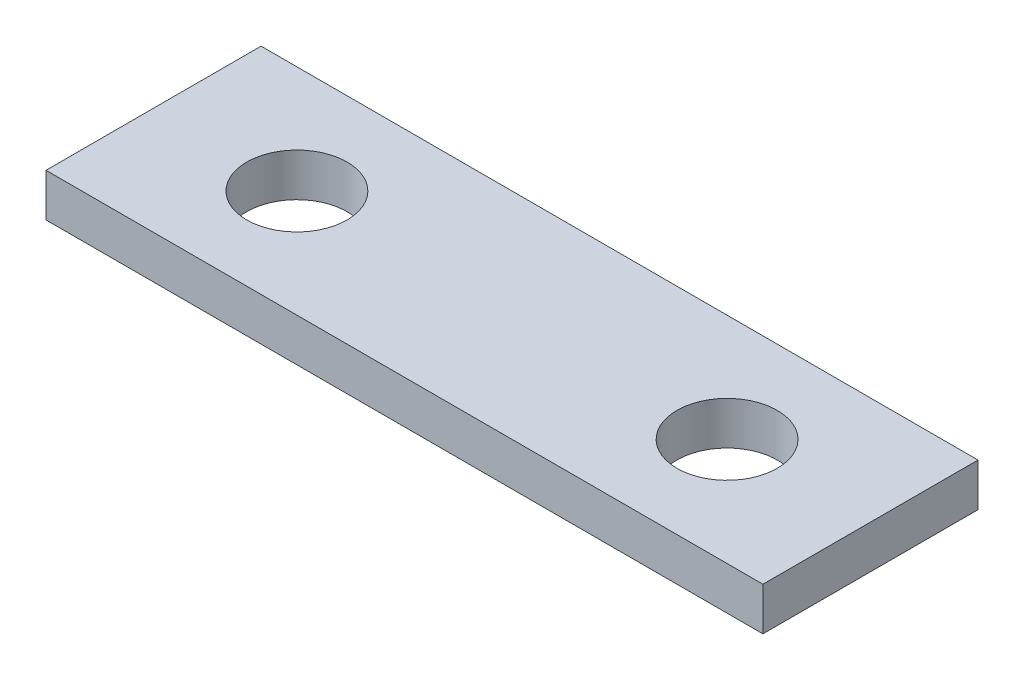
from build123d import *

# Parameters (mm, degrees)
SKETCH_1_W      = 100
SKETCH_1_H      = 30
SKETCH_1_R      = 7
EXTRUDE_1_DEPTH = 6


with BuildPart() as part:
    # 草图1 → 凸台-拉伸1 (new body)
    with BuildSketch(Plane(origin=(0, 0, 0), x_dir=(1, 0, 0), z_dir=(0, 1, 0))):
        with Locations((50, 15)):
            Rectangle(SKETCH_1_W, SKETCH_1_H)
        with Locations(Location((20, 15, 0), (0, 0, 270))):
            Circle(SKETCH_1_R, mode=Mode.SUBTRACT)
        with Locations(Location((80, 15, 0), (0, 0, 270))):
            Circle(SKETCH_1_R, mode=Mode.SUBTRACT)
    extrude(amount=EXTRUDE_1_DEPTH)


solid = part.part
